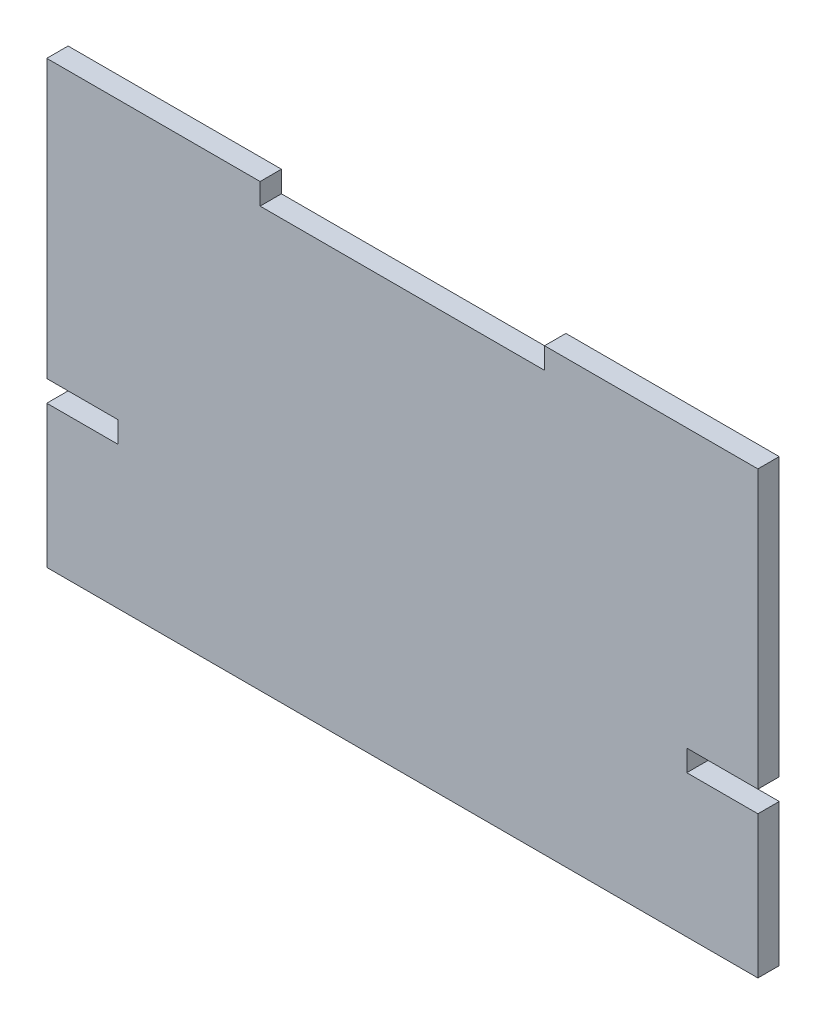
from build123d import *

# Parameters (mm, degrees)
BOSS_EXTRUDE1_DEPTH = 3


with BuildPart() as part:
    # Sketch1 → Boss-Extrude1 (new body)
    with BuildSketch(Plane.XY):
        Polygon((-20, 31), (-20, 28), (20, 28), (20, 31), (50, 31), (50, -8), (40, -8), (40, -11), (50, -11), (50, -31), (-50, -31), (-50, -11), (-40, -11), (-40, -8), (-50, -8), (-50, 31), align=None)
    extrude(amount=BOSS_EXTRUDE1_DEPTH)


solid = part.part
